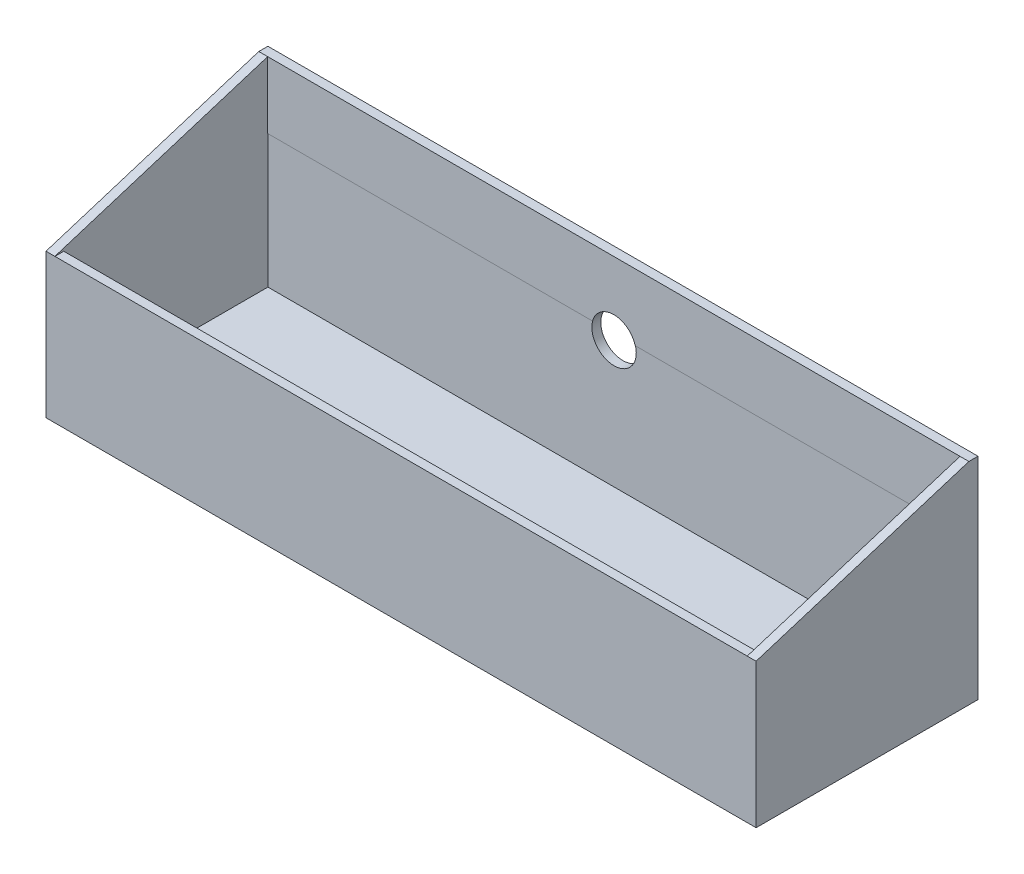
from build123d import *

# Parameters (mm, degrees)
SKETCH1_W           = 160
SKETCH1_H           = 50
BOSS_EXTRUDE1_DEPTH = 2.5
SKETCH2_R           = 3.75
CUT_EXTRUDE1_DEPTH  = 168.649187293
SKETCH3_W           = 160
SKETCH3_H           = 50
SKETCH3_W_2         = 156
SKETCH3_H_2         = 46
BOSS_EXTRUDE2_DEPTH = 30
SKETCH5_W           = 160
SKETCH5_H           = 2.049984413
BOSS_EXTRUDE4_DEPTH = 15
BOSS_EXTRUDE5_DEPTH = 2
BOSS_EXTRUDE7_DEPTH = 2
SKETCH9_R           = 5
CUT_EXTRUDE2_DEPTH  = 3


with BuildPart() as part:
    # Sketch1 → Boss-Extrude1 (new body)
    with BuildSketch(Plane(origin=(0, 0, 0), x_dir=(1, 0, 0), z_dir=(0, 1, 0))):
        with Locations((80, -25)):
            Rectangle(SKETCH1_W, SKETCH1_H)
    extrude(amount=BOSS_EXTRUDE1_DEPTH)

    # Sketch2 → Cut-Extrude1 (cut, through all)
    with BuildSketch(Plane(origin=(0, 2.5, 0), x_dir=(1, 0, 0), z_dir=(0, 1, 0))):
        with Locations(Location((15, -25, 0), (0, 0, 270))):
            Circle(SKETCH2_R)
        with Locations(Location((36, -25, 0), (0, 0, 270))):
            Circle(SKETCH2_R)
        with Locations(Location((57, -25, 0), (0, 0, 270))):
            Circle(SKETCH2_R)
        with Locations(Location((78, -25, 0), (0, 0, 270))):
            Circle(SKETCH2_R)
        with Locations(Location((99, -25, 0), (0, 0, 270))):
            Circle(SKETCH2_R)
        with Locations(Location((120, -25, 0), (0, 0, 270))):
            Circle(SKETCH2_R)
        with Locations(Location((141, -25, 0), (0, 0, 270))):
            Circle(SKETCH2_R)
    extrude(amount=-CUT_EXTRUDE1_DEPTH, mode=Mode.SUBTRACT)

    # Sketch3 → Boss-Extrude2 (add)
    with BuildSketch(Plane(origin=(0, 2.5, 0), x_dir=(1, 0, 0), z_dir=(0, 1, 0))):
        with Locations((80, -25)):
            Rectangle(SKETCH3_W, SKETCH3_H)
        with Locations((80, -25)):
            Rectangle(SKETCH3_W_2, SKETCH3_H_2, mode=Mode.SUBTRACT)
    extrude(amount=BOSS_EXTRUDE2_DEPTH)

    # Sketch5 → Boss-Extrude4 (add)
    with BuildSketch(Plane(origin=(0, 32.5, 0), x_dir=(1, 0, 0), z_dir=(0, 1, 0))):
        with Locations((80, -1.024992207)):
            Rectangle(SKETCH5_W, SKETCH5_H)
    extrude(amount=BOSS_EXTRUDE4_DEPTH)

    # Sketch6 → Boss-Extrude5 (add)
    with BuildSketch(Plane(origin=(160, 0, 0), x_dir=(0, 0, -1), z_dir=(1, 0, 0))):
        Polygon((-2.049984413, 32.5), (-50, 32.5), (-2.049984413, 47.5), align=None)
    extrude(amount=-BOSS_EXTRUDE5_DEPTH)

    # Sketch8 → Boss-Extrude7 (add)
    with BuildSketch(Plane.ZY):
        Polygon((2.049984413, 47.5), (2.049984413, 32.5), (50, 32.5), align=None)
    extrude(amount=-BOSS_EXTRUDE7_DEPTH)

    # Sketch9 → Cut-Extrude2 (cut)
    with BuildSketch(Plane(origin=(0, 0, 0), x_dir=(-1, 0, 0), z_dir=(0, 0, -1))):
        with Locations((-80, 31.153444526)):
            Circle(SKETCH9_R)
    extrude(amount=-CUT_EXTRUDE2_DEPTH, mode=Mode.SUBTRACT)


solid = part.part
